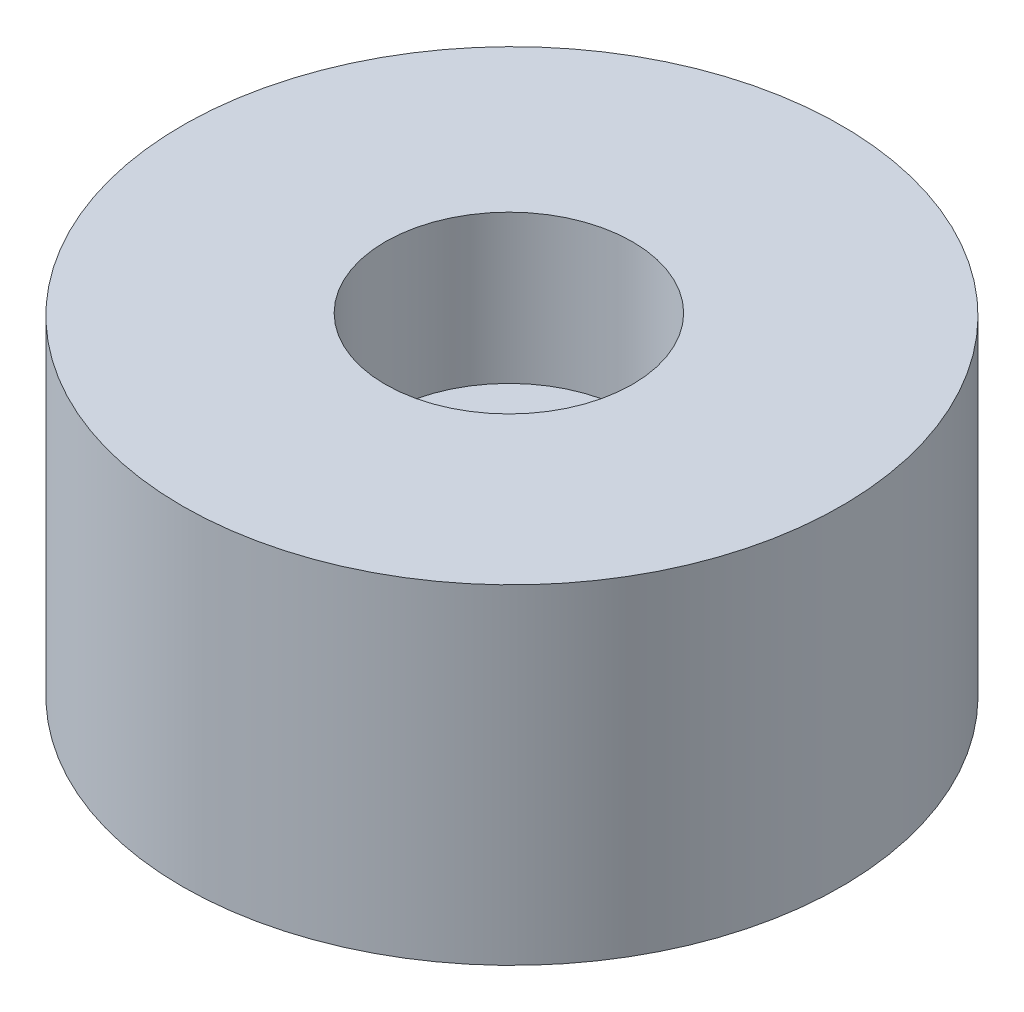
from build123d import *

# Parameters (mm, degrees)
SKETCH1_R           = 20
BOSS_EXTRUDE3_DEPTH = 20
SKETCH4_R           = 7.5
CUT_EXTRUDE1_DEPTH  = 9


with BuildPart() as part:
    # Sketch1 → Boss-Extrude3 (new body)
    with BuildSketch(Plane(origin=(0, 0, 0), x_dir=(1, 0, 0), z_dir=(0, 1, 0))):
        with Locations(Location((-17.278667571, 9.164673689, 0), (0, 0, 270))):
            Circle(SKETCH1_R)
    extrude(amount=BOSS_EXTRUDE3_DEPTH)

    # Sketch4 → Cut-Extrude1 (cut)
    with BuildSketch(Plane(origin=(0, 20, 0), x_dir=(1, 0, 0), z_dir=(0, 1, 0))):
        with Locations(Location((-17.513426745, 9.214979227, 0), (0, 0, 270))):
            Circle(SKETCH4_R)
    extrude(amount=-CUT_EXTRUDE1_DEPTH, mode=Mode.SUBTRACT)


solid = part.part
